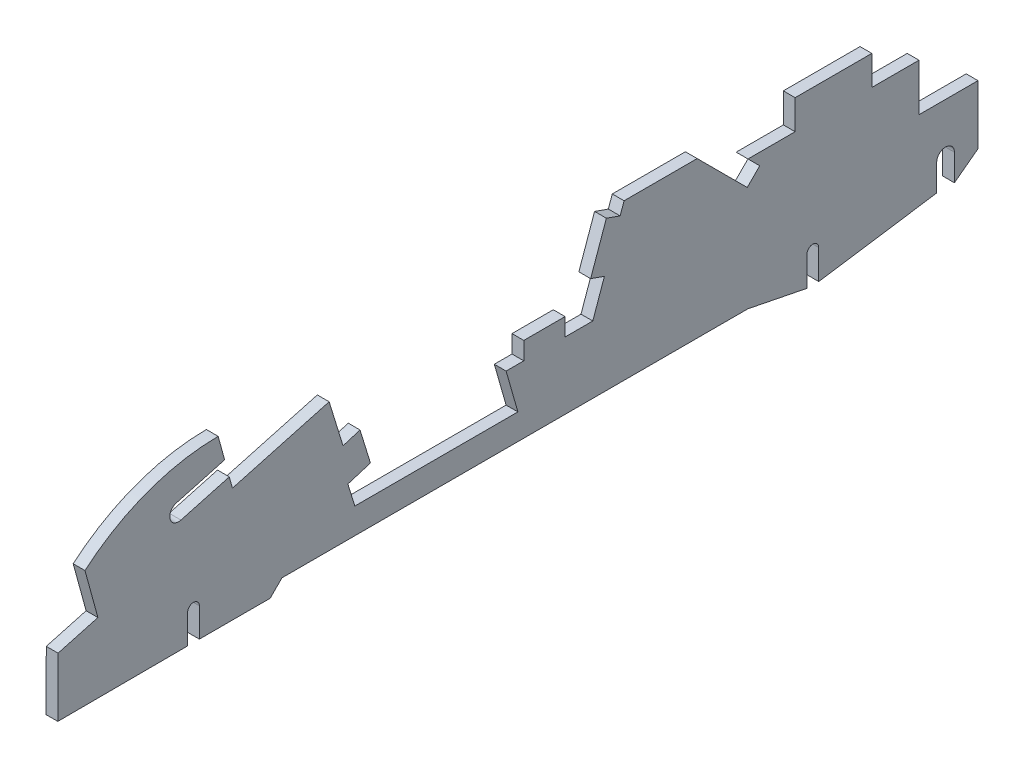
from build123d import *

# Parameters (mm, degrees)
RESSALTO_EXTRUS_O1_DEPTH = 2


with BuildPart() as part:
    # Esboço1 → Ressalto-extrusão1 (new body)
    with BuildSketch(Plane(origin=(0, 0, 0), x_dir=(0, 0, -1), z_dir=(1, 0, 0))):
        with BuildLine():
            Line((0, 0), (-10, 0))
            Line((-10, 0), (-10, 8))
            Line((-10, 8), (-18, 8))
            Line((-18, 8), (-18, 13))
            Line((-18, 13), (-31, 13))
            Line((-31, 13), (-31, 8))
            Line((-31, 8), (-39, 8))
            Line((-39, 8), (-37, 6))
            Line((-37, 6), (-39.121320344, 3.878679656))
            Line((-39.121320344, 3.878679656), (-47.606601718, 12.363961031))
            Line((-47.606601718, 12.363961031), (-60, 12.363961031))
            Line((-60, 12.363961031), (-60.666666667, 10.478342948))
            Line((-60.666666667, 10.478342948), (-63, 11.303300859))
            Line((-63, 11.303300859), (-65.666666667, 3.760828526))
            Line((-65.666666667, 3.760828526), (-63.333333333, 2.935870615))
            Line((-63.333333333, 2.935870615), (-65.303300859, -2.636038969))
            Line((-65.303300859, -2.636038969), (-70, -2.636038969))
            Line((-70, -2.636038969), (-70, 0.363961031))
            Line((-70, 0.363961031), (-77, 0.363961031))
            Line((-77, 0.363961031), (-77, -2.636038969))
            Line((-77, -2.636038969), (-80, -2.636038969))
            Line((-80, -2.636038969), (-78, -9.636038969))
            Line((-78, -9.636038969), (-105.645751311, -9.636038969))
            Line((-105.645751311, -9.636038969), (-106.822875656, -5.813163314))
            Line((-106.822875656, -5.813163314), (-103, -4.636038969))
            Line((-103, -4.636038969), (-104.765686517, 1.098274514))
            Line((-104.765686517, 1.098274514), (-107.645751311, 0.21145666))
            Line((-107.645751311, 0.21145666), (-110, 7.857207972))
            Line((-110, 7.857207972), (-126.395448513, 3.363961031))
            Line((-126.395448513, 3.363961031), (-126.9240658, 5.292837326))
            Line((-126.9240658, 5.292837326), (-135.121790056, 3.046213856))
            ThreePointArc((-135.121790056, 3.046213856), (-136.964910243, 4.096408112), (-135.914715987, 5.939528299))
            Line((-135.914715987, 5.939528299), (-127.71699173, 8.18615177))
            Line((-127.71699173, 8.18615177), (-128.813209852, 12.18615177))
            ThreePointArc((-128.813209852, 12.18615177), (-140.849618713, 9.983199212), (-151.392124565, 3.771620619))
            Line((-151.392124565, 3.771620619), (-149.199688323, -4.228379381))
            Line((-149.199688323, -4.228379381), (-155.950755357, -6.078539886))
            Line((-155.950755357, -6.078539886), (-156, -16.078539886))
            Line((-156, -16.078539886), (-134, -16))
            Line((-134, -16), (-134, -11.101020514))
            ThreePointArc((-134, -11.101020514), (-133, -10.101020514), (-132, -11.101020514))
            Line((-132, -11.101020514), (-132, -16))
            Line((-132, -16), (-120, -16))
            Line((-120, -16), (-118, -14))
            Line((-118, -14), (-39, -14))
            Line((-39, -14), (-29, -16))
            Line((-29, -16), (-29, -11))
            ThreePointArc((-29, -11), (-28, -10), (-27, -11))
            Line((-27, -11), (-27, -16))
            Line((-27, -16), (-7, -13))
            Line((-7, -13), (-7, -8.5))
            ThreePointArc((-7, -8.5), (-5.5, -7), (-4, -8.5))
            Line((-4, -8.5), (-4, -13))
            Line((-4, -13), (0, -10))
            Line((0, -10), (0, 0))
        make_face()
    extrude(amount=RESSALTO_EXTRUS_O1_DEPTH)


solid = part.part
